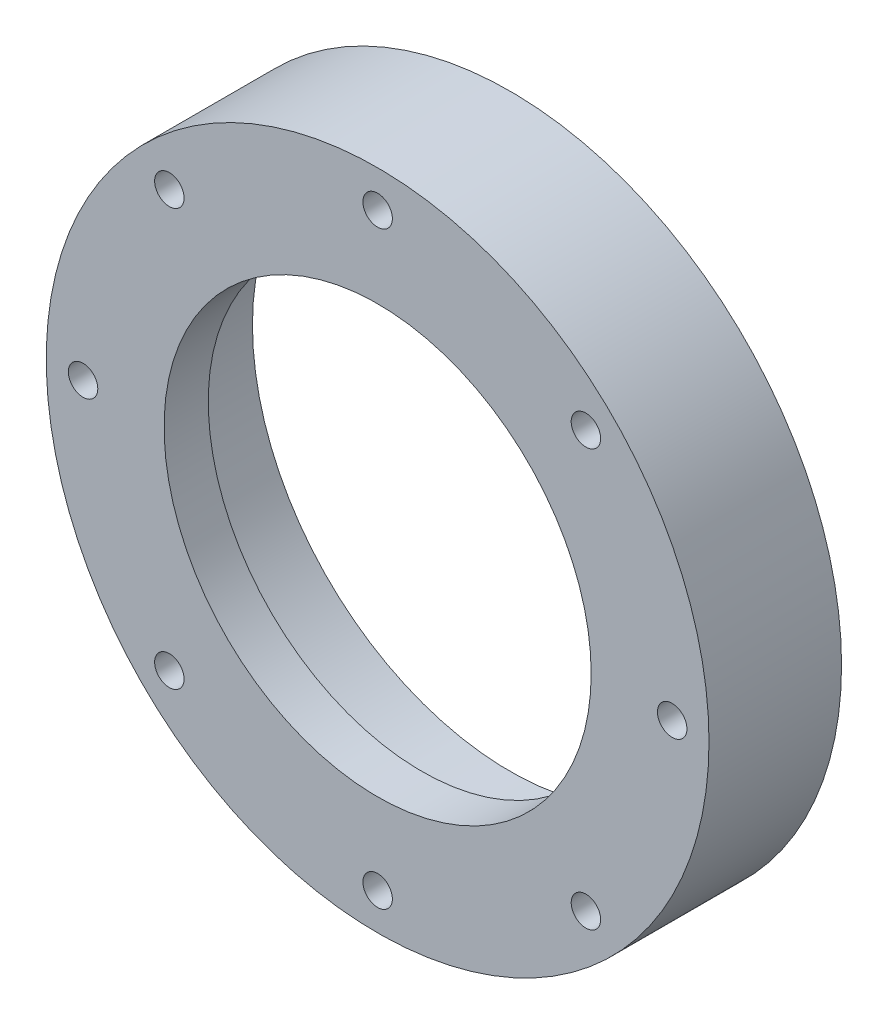
from build123d import *

# Parameters (mm, degrees)
SKETCH_1_R          = 45
SKETCH_1_R_2        = 35
EXTRUDE_1_DEPTH     = 12
SKETCH_2_R          = 45
SKETCH_2_R_2        = 29
EXTRUDE_2_DEPTH     = 6
SKETCH_4_R          = 2
CUT_EXTRUDE_1_DEPTH = 18


with BuildPart() as part:
    # 草图1 → 凸台-拉伸1 (new body)
    with BuildSketch(Plane.XY):
        Circle(SKETCH_1_R)
        Circle(SKETCH_1_R_2, mode=Mode.SUBTRACT)
    extrude(amount=EXTRUDE_1_DEPTH)

    # 草图2 → 凸台-拉伸2 (add)
    with BuildSketch(Plane.XY.offset(12)):
        Circle(SKETCH_2_R)
        Circle(SKETCH_2_R_2, mode=Mode.SUBTRACT)
    extrude(amount=EXTRUDE_2_DEPTH)

    # 草图4 → 切除-拉伸1 (cut)
    with BuildSketch(Plane.XY.offset(18)):
        with Locations((0, 40)):
            Circle(SKETCH_4_R)
        with Locations((28.284271247, 28.284271247)):
            Circle(SKETCH_4_R)
        with Locations((40, 0)):
            Circle(SKETCH_4_R)
        with Locations((28.284271247, -28.284271247)):
            Circle(SKETCH_4_R)
        with Locations((0, -40)):
            Circle(SKETCH_4_R)
        with Locations((-28.284271247, -28.284271247)):
            Circle(SKETCH_4_R)
        with Locations((-40, 0)):
            Circle(SKETCH_4_R)
        with Locations((-28.284271247, 28.284271247)):
            Circle(SKETCH_4_R)
    extrude(amount=-CUT_EXTRUDE_1_DEPTH, mode=Mode.SUBTRACT)


solid = part.part
